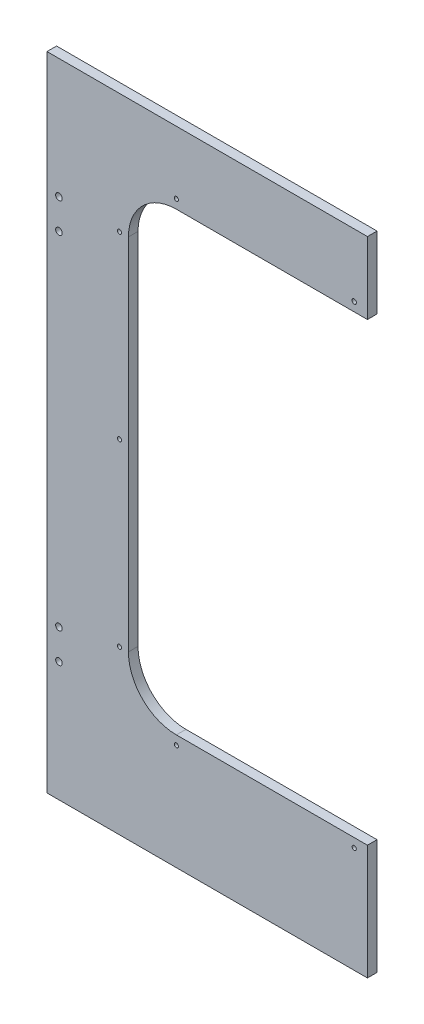
from build123d import *

# Parameters (mm, degrees)
SKETCH1_W           = 267.5
SKETCH1_H           = 536
SKETCH1_R           = 2.75
BOSS_EXTRUDE1_DEPTH = 8
CUT_EXTRUDE1_DEPTH  = 8
SKETCH3_R           = 1.864271291
SKETCH3_R_2         = 1.75
CUT_EXTRUDE2_DEPTH  = 10


with BuildPart() as part:
    # Sketch1 → Boss-Extrude1 (new body)
    with BuildSketch(Plane.XY):
        with Locations((-133.75, 0)):
            Rectangle(SKETCH1_W, SKETCH1_H)
        with Locations((-257.509341423, -143.000001745)):
            Circle(SKETCH1_R, mode=Mode.SUBTRACT)
        with Locations(Location((-257.5, 168, 0), (0, 0, 180))):
            Circle(SKETCH1_R, mode=Mode.SUBTRACT)
        with Locations(Location((-257.509341423, 143.000001745, 0), (0, 0, 180))):
            Circle(SKETCH1_R, mode=Mode.SUBTRACT)
        with Locations((-257.5, -168)):
            Circle(SKETCH1_R, mode=Mode.SUBTRACT)
    extrude(amount=BOSS_EXTRUDE1_DEPTH)

    # Sketch2 → Cut-Extrude1 (cut)
    with BuildSketch(Plane.XY.offset(8)):
        with BuildLine():
            Line((-159.5, 208), (160.5, 208))
            ThreePointArc((160.5, 208), (188.784271247, 196.284271247), (200.5, 168))
            Line((200.5, 168), (200.5, -132))
            ThreePointArc((200.5, -132), (188.784271247, -160.284271247), (160.5, -172))
            Line((160.5, -172), (-159.5, -172))
            ThreePointArc((-159.5, -172), (-187.784271247, -160.284271247), (-199.5, -132))
            Line((-199.5, -132), (-199.5, 168))
            ThreePointArc((-199.5, 168), (-187.784271247, 196.284271247), (-159.5, 208))
        make_face()
    extrude(amount=-CUT_EXTRUDE1_DEPTH, mode=Mode.SUBTRACT)

    # Sketch3 → Cut-Extrude2 (cut)
    with BuildSketch(Plane.XY.offset(8)):
        with Locations((-11.058771906, 215.5)):
            Circle(SKETCH3_R)
        with Locations((-159.5, 215.5)):
            Circle(SKETCH3_R_2)
        with Locations((-207, 168)):
            Circle(SKETCH3_R_2)
        with Locations((-207, 18)):
            Circle(SKETCH3_R_2)
        with Locations((-207, -132)):
            Circle(SKETCH3_R_2)
        with Locations((-159.5, -179.5)):
            Circle(SKETCH3_R_2)
        with Locations((-11.058771906, -179.5)):
            Circle(SKETCH3_R_2)
    extrude(amount=-CUT_EXTRUDE2_DEPTH, mode=Mode.SUBTRACT)


solid = part.part
